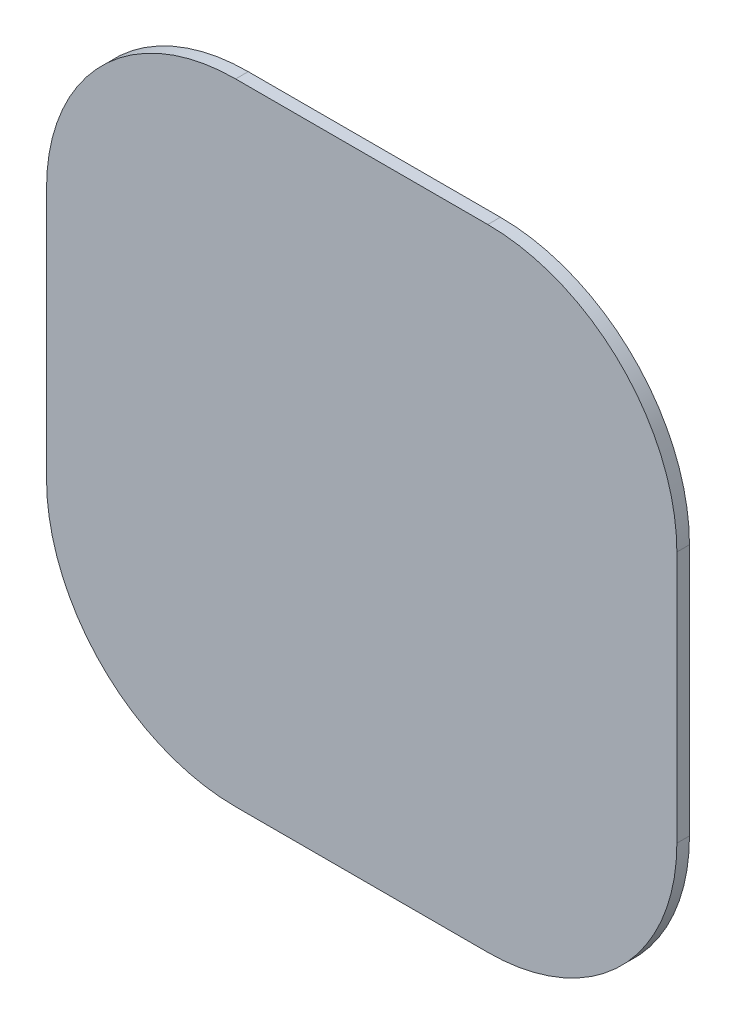
from build123d import *

# Parameters (mm, degrees)
BOSS_EXTRUDE1_DEPTH = 3


with BuildPart() as part:
    # Sketch1 → Boss-Extrude1 (new body)
    with BuildSketch(Plane.XY):
        with BuildLine():
            Line((-30, 53.5), (30, 53.5))
            ThreePointArc((30, 53.5), (61.819805153, 40.319805153), (75, 8.5))
            Line((75, 8.5), (75, -51.5))
            ThreePointArc((75, -51.5), (61.819805153, -83.319805153), (30, -96.5))
            Line((30, -96.5), (0.5, -96.5))
            Line((0.5, -96.5), (-0.5, -96.5))
            Line((-0.5, -96.5), (-30, -96.5))
            ThreePointArc((-30, -96.5), (-61.819805153, -83.319805153), (-75, -51.5))
            Line((-75, -51.5), (-75, 8.5))
            ThreePointArc((-75, 8.5), (-61.819805153, 40.319805153), (-30, 53.5))
        make_face()
    extrude(amount=BOSS_EXTRUDE1_DEPTH)


solid = part.part
